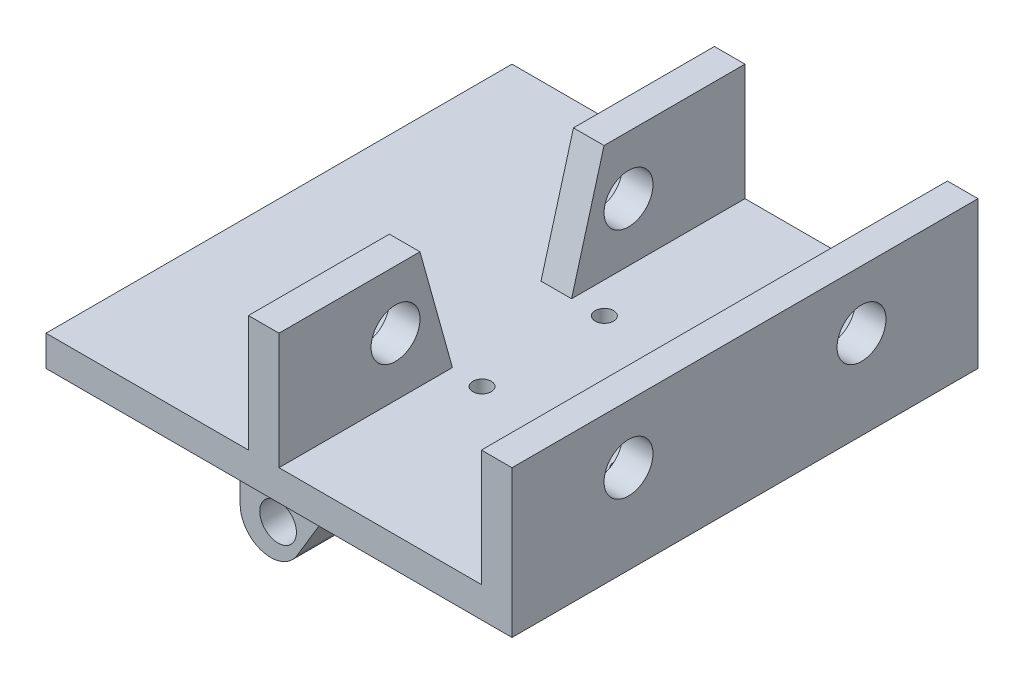
from build123d import *

# Parameters (mm, degrees)
SKETCH2_W           = 76.2
SKETCH2_H           = 76.2
SKETCH2_R           = 1.5
BOSS_EXTRUDE1_DEPTH = 5
SKETCH3_W           = 76.2
SKETCH3_H           = 24.05
SKETCH3_R           = 4
BOSS_EXTRUDE2_DEPTH = 5
LPATTERN1_COUNT     = 2
LPATTERN1_PITCH     = 38.1
BOSS_EXTRUDE5_START = -38.1
SKETCH4_R           = 3
BOSS_EXTRUDE5_DEPTH = 6.35
CUT_EXTRUDE1_DEPTH  = 10


with BuildPart() as part:
    # Sketch2 → Boss-Extrude1 (new body)
    with BuildSketch(Plane(origin=(0, 0, 0), x_dir=(1, 0, 0), z_dir=(0, 1, 0))):
        Rectangle(SKETCH2_W, SKETCH2_H)
        with Locations(Location((28.1, 10, 0), (0, 0, 270))):
            Circle(SKETCH2_R, mode=Mode.SUBTRACT)
        with Locations(Location((5.1, 10, 0), (0, 0, 270))):
            Circle(SKETCH2_R, mode=Mode.SUBTRACT)
        with Locations(Location((28.1, -10, 0), (0, 0, 90))):
            Circle(SKETCH2_R, mode=Mode.SUBTRACT)
        with Locations(Location((5.1, -10, 0), (0, 0, 90))):
            Circle(SKETCH2_R, mode=Mode.SUBTRACT)
    extrude(amount=BOSS_EXTRUDE1_DEPTH)

    # Sketch3 → Boss-Extrude2 (add)
    with BuildSketch(Plane(origin=(38.1, 0, 0), x_dir=(0, 0, -1), z_dir=(1, 0, 0))):
        with Locations((0, 12.025)):
            Rectangle(SKETCH3_W, SKETCH3_H)
        with Locations((-19.05, 14.525)):
            Circle(SKETCH3_R, mode=Mode.SUBTRACT)
        with Locations((19.05, 14.525)):
            Circle(SKETCH3_R, mode=Mode.SUBTRACT)
    boss_extrude2 = extrude(amount=-BOSS_EXTRUDE2_DEPTH)

    # LPattern1: Boss-Extrude2 ×2
    with Locations(*[(-i * LPATTERN1_PITCH, 0, 0) for i in range(1, LPATTERN1_COUNT)]):
        add(boss_extrude2)

    # Sketch4 → Boss-Extrude5 (add, symmetric)
    with BuildSketch(Plane(origin=(0, 0, -38.1), x_dir=(-1, 0, 0), z_dir=(0, 0, -1)).offset(BOSS_EXTRUDE5_START)):
        with BuildLine():
            Line((6.1, 0), (38.1, 0))
            Line((38.1, 0), (38.1, -35.148267781))
            ThreePointArc((38.1, -35.148267781), (34.438424912, -39.965800215), (28.816552498, -37.72742995))
            Line((28.816552498, -37.72742995), (6.1, 0))
        make_face()
        with Locations((31.9, -34.5)):
            Circle(SKETCH4_R, mode=Mode.SUBTRACT)
    extrude(amount=BOSS_EXTRUDE5_DEPTH, both=True)

    # Sketch5 → Cut-Extrude1 (cut)
    with BuildSketch(Plane(origin=(0, 0, 0), x_dir=(0, 0, -1), z_dir=(1, 0, 0))):
        Polygon((9.743329583, 5), (-9.743329583, 5), (-15.05, 24.05), (-9.743329583, 24.05), (9.743329583, 24.05), (15.05, 24.05), align=None)
    extrude(amount=-CUT_EXTRUDE1_DEPTH, mode=Mode.SUBTRACT)


solid = part.part
